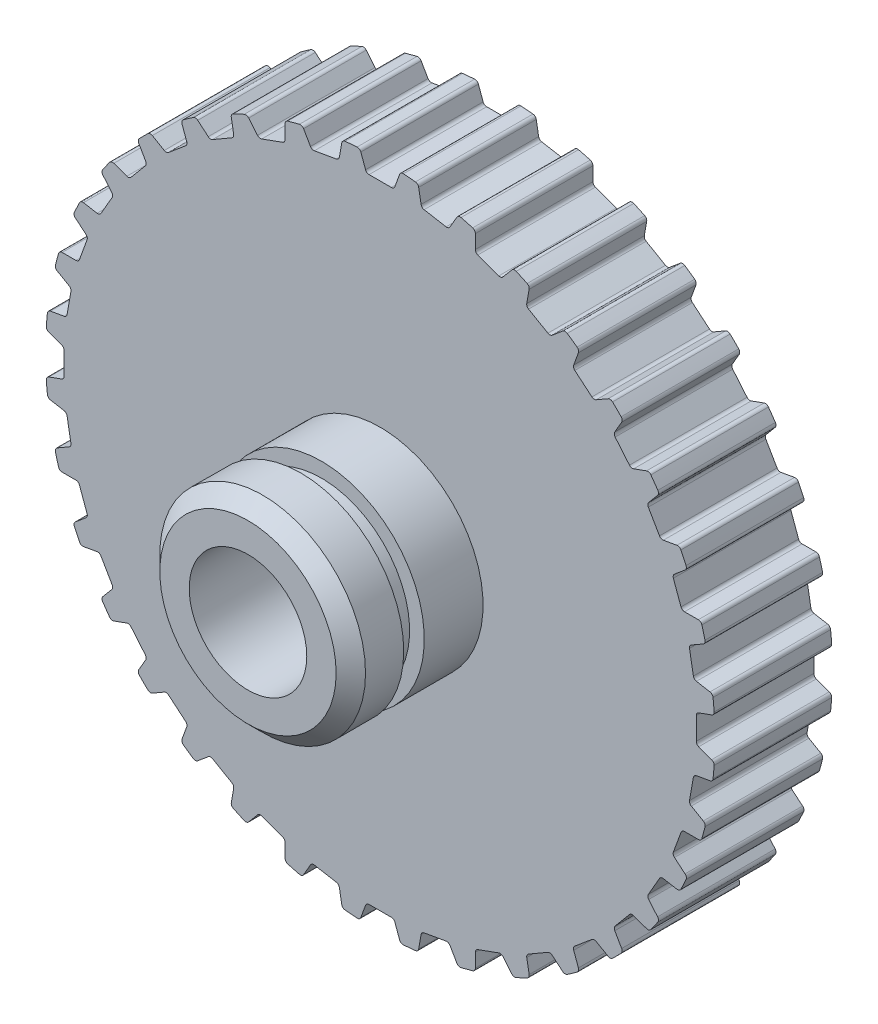
from build123d import *

# Parameters (mm, degrees)
GEARBELT_BASESKETCH_W    = 4
GEARBELT_BASESKETCH_H    = 9.388502397
TOOTH_EXTRUDE_START      = -2
TOOTH_EXTRUDE_DEPTH      = 4
TOOTH_PATTERN_36_COUNT   = 36
BOSS_EXTRUDE1_DEPTH      = 4.5
BOSS_EXTRUDE1_DEPTH_BACK = 8.5
SKETCH3_R                = 3.5
SKETCH3_R_2              = 2
SKETCH5_W                = 0.7
SKETCH5_H                = 0.5
CHAMFER1_SIZE            = 0.5


with BuildPart() as part:
    # GearBelt-BaseSketch → 0.080in Pitch 'MXL', 0.125in Belt Width, 23,2850mm P.D. (revolve)
    with BuildSketch(Plane(origin=(0, 0, 0), x_dir=(0, 0, -1), z_dir=(1, 0, 0)), mode=Mode.PRIVATE) as f_0_080in_pitch_mxl_0_125in_belt_width_sk:
        with Locations((0, 6.694251198)):
            Rectangle(GEARBELT_BASESKETCH_W, GEARBELT_BASESKETCH_H)
    revolve(f_0_080in_pitch_mxl_0_125in_belt_width_sk.sketch.rotate(Axis((0, 0, 0), (0, 0, -1)), 90), axis=Axis((0, 0, 0), (0, 0, -1)))

    # Tooth-Sketch → Tooth-Extrude (cut)
    with BuildSketch(Plane.XY.offset(TOOTH_EXTRUDE_START)):
        with BuildLine():
            Line((-0.379703626, 10.753502407), (0.379703626, 10.753502407))
            ThreePointArc((0.379703626, 10.753502407), (0.452547836, 10.776470098), (0.499044593, 10.837065851))
            Line((0.499044593, 10.837065851), (0.659521673, 11.277973005))
            ThreePointArc((0.659521673, 11.277973005), (0.709661721, 11.34102698), (0.787646153, 11.361232344))
            Line((0.787646153, 11.361232344), (0.787646153, 13.901232344))
            Line((0.787646153, 13.901232344), (-0.787646153, 13.901232344))
            Line((-0.787646153, 13.901232344), (-0.787646153, 11.361232344))
            ThreePointArc((-0.787646153, 11.361232344), (-0.709661721, 11.34102698), (-0.659521673, 11.277973005))
            Line((-0.659521673, 11.277973005), (-0.499044593, 10.837065851))
            ThreePointArc((-0.499044593, 10.837065851), (-0.452547836, 10.776470098), (-0.379703626, 10.753502407))
        make_face()
    tooth_extrude = extrude(amount=TOOTH_EXTRUDE_DEPTH, mode=Mode.SUBTRACT)

    # Tooth Pattern, 36: Tooth-Extrude ×36 about axis
    tooth_pattern_36_axis = Axis((0, 0, 0), (0, 0, 1))
    for i in range(1, TOOTH_PATTERN_36_COUNT):
        add(tooth_extrude.rotate(tooth_pattern_36_axis, i * 360 / TOOTH_PATTERN_36_COUNT), mode=Mode.SUBTRACT)

    # Sketch3 → Boss-Extrude1 (add, two sides: drawn at the far end of the back side and taken through both)
    with BuildSketch(Plane.XY.offset(2).offset(-BOSS_EXTRUDE1_DEPTH_BACK)):
        Circle(SKETCH3_R)
        Circle(SKETCH3_R_2, mode=Mode.SUBTRACT)
    extrude(amount=BOSS_EXTRUDE1_DEPTH + BOSS_EXTRUDE1_DEPTH_BACK)

    # Sketch5 → Cut-Revolve1 (revolve, cut)
    with BuildSketch(Plane(origin=(0, 0, 0), x_dir=(0, 0, -1), z_dir=(1, 0, 0)), mode=Mode.PRIVATE) as cut_revolve1_sk:
        with Locations((-4.35, -3.25)):
            Rectangle(SKETCH5_W, SKETCH5_H)
    cut_revolve1 = revolve(cut_revolve1_sk.sketch.rotate(Axis((0, 0, -88.99), (0, 0, 1)), 270), axis=Axis((0, 0, -88.99), (0, 0, 1)), mode=Mode.SUBTRACT)

    # Mirror1: Cut-Revolve1 across plane
    add(cut_revolve1.mirror(Plane.XY), mode=Mode.SUBTRACT)

    # Chamfer1
    chamfer1_edges = [part.edges().sort_by_distance(p)[0] for p in [
        (-3.5, 0, -6.5),
        (-3.5, 0, 6.5),
    ]]
    chamfer(chamfer1_edges, length=CHAMFER1_SIZE)


solid = part.part
